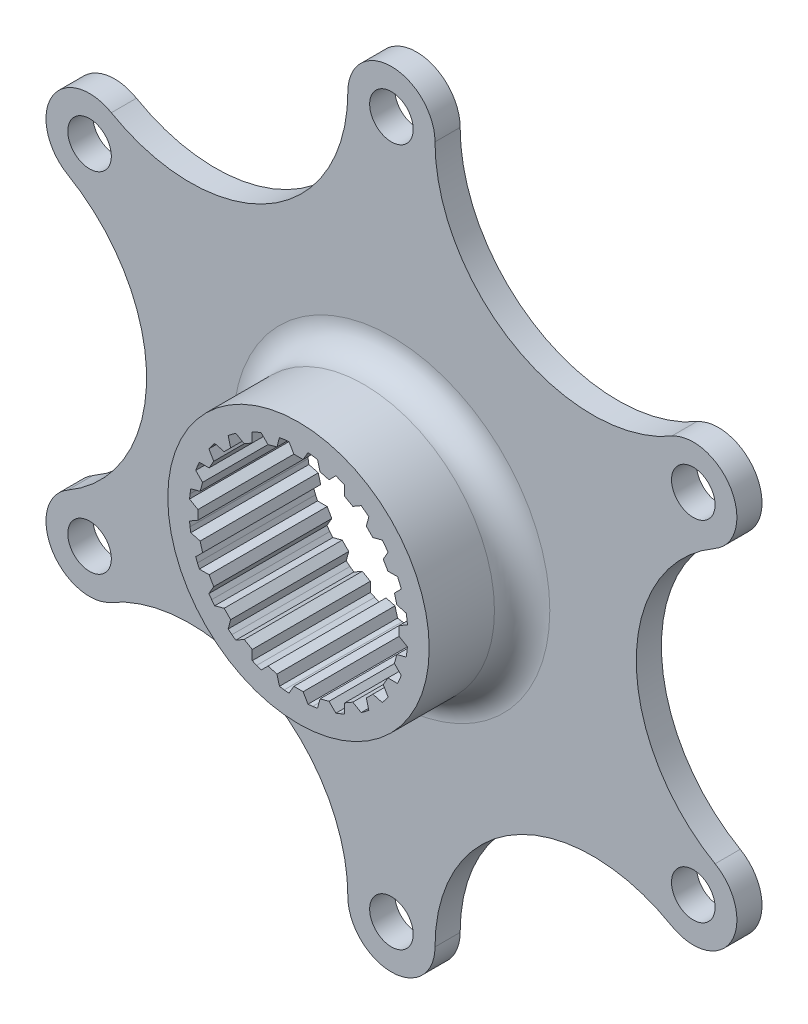
from build123d import *

# Parameters (mm, degrees)
SKETCH1_R           = 115
BOSS_EXTRUDE1_DEPTH = 13.55
CUT_EXTRUDE1_DEPTH  = 165.87695412
SKETCH3_R           = 95
SKETCH3_R_2         = 30
CUT_EXTRUDE13_DEPTH = 16.06
FILLET1_R           = 6.35
CUT_EXTRUDE14_START = -5.27
SKETCH7_R           = 95
SKETCH7_R_2         = 30
CUT_EXTRUDE14_DEPTH = 5.27
SKETCH8_R           = 115
SKETCH8_R_2         = 95
CUT_EXTRUDE17_DEPTH = 165.87695412
SKETCH9_R           = 5
CUT_EXTRUDE20_DEPTH = 138.056229337
SKETCH10_R          = 95
CUT_EXTRUDE21_DEPTH = 138.056229337
CUT_EXTRUDE22_START = -5.27
SKETCH11_R          = 30
CUT_EXTRUDE22_DEPTH = 5.27
BOSS_EXTRUDE2_START = 5.27
SKETCH13_R          = 30
BOSS_EXTRUDE2_DEPTH = 5.27


with BuildPart() as part:
    # Sketch1 → Boss-Extrude1 (new, symmetric)
    with BuildSketch(Plane.XY):
        with Locations(Location((0, 0, 0), (0, 0, 180))):
            Circle(SKETCH1_R)
    extrude(amount=BOSS_EXTRUDE1_DEPTH, both=True)

    # Sketch2 → Cut-Extrude1 (cut, through all)
    with BuildSketch(Plane.XY.offset(13.55)):
        Polygon((1.065531645, 23.075412075), (-1.065531645, 23.075412075), (-2.179683155, 25.005179098), (-3.276207422, 24.885266028), (-4.366404324, 24.717291794), (-4.943131584, 22.564916358), (-7.001580653, 22.013356593), (-8.577228829, 23.589004769), (-9.605354159, 23.189376271), (-10.614928564, 22.744961902), (-10.614928564, 20.516658882), (-12.460483511, 19.451127237), (-14.390250533, 20.565278747), (-15.279911876, 19.913168845), (-16.140062965, 19.222600444), (-15.563335705, 17.070225009), (-17.070225009, 15.563335705), (-19.222600444, 16.140062965), (-19.913168849, 15.27991187), (-20.565278747, 14.390250533), (-19.451127237, 12.460483511), (-20.516658882, 10.614928564), (-22.744961902, 10.614928564), (-23.189376274, 9.605354152), (-23.589004769, 8.577228829), (-22.013356593, 7.001580653), (-22.564916358, 4.943131584), (-24.717291794, 4.366404324), (-24.885266028, 3.276207422), (-25.005179098, 2.179683155), (-23.075412075, 1.065531645), (-23.075412075, -1.065531645), (-25.005179098, -2.179683155), (-24.885266027, -3.276207429), (-24.717291794, -4.366404324), (-22.564916358, -4.943131584), (-22.013356593, -7.001580653), (-23.589004769, -8.577228829), (-23.189376271, -9.605354159), (-22.744961902, -10.614928564), (-20.516658882, -10.614928564), (-19.451127237, -12.460483511), (-20.565278747, -14.390250533), (-19.913168845, -15.279911876), (-19.222600444, -16.140062965), (-17.070225009, -15.563335705), (-15.563335705, -17.070225009), (-16.140062965, -19.222600444), (-15.27991187, -19.913168849), (-14.390250533, -20.565278747), (-12.460483511, -19.451127237), (-10.614928564, -20.516658882), (-10.614928564, -22.744961902), (-9.605354152, -23.189376274), (-8.577228829, -23.589004769), (-7.001580653, -22.013356593), (-4.943131584, -22.564916358), (-4.366404324, -24.717291794), (-3.276207422, -24.885266028), (-2.179683155, -25.005179098), (-1.065531645, -23.075412075), (1.065531645, -23.075412075), (2.179683155, -25.005179098), (3.276207429, -24.885266027), (4.366404324, -24.717291794), (4.943131584, -22.564916358), (7.001580653, -22.013356593), (8.577228829, -23.589004769), (9.605354159, -23.189376271), (10.614928564, -22.744961902), (10.614928564, -20.516658882), (12.460483511, -19.451127237), (14.390250533, -20.565278747), (15.279911876, -19.913168845), (16.140062965, -19.222600444), (15.563335705, -17.070225009), (17.070225009, -15.563335705), (19.222600444, -16.140062965), (19.913168849, -15.27991187), (20.565278747, -14.390250533), (19.451127237, -12.460483511), (20.516658882, -10.614928564), (22.744961902, -10.614928564), (23.189376274, -9.605354152), (23.589004769, -8.577228829), (22.013356593, -7.001580653), (22.564916358, -4.943131584), (24.717291794, -4.366404324), (24.885266028, -3.276207422), (25.005179098, -2.179683155), (23.075412075, -1.065531645), (23.075412075, 1.065531645), (25.005179098, 2.179683155), (24.885266027, 3.276207429), (24.717291794, 4.366404324), (22.564916358, 4.943131584), (22.013356593, 7.001580653), (23.589004769, 8.577228829), (23.189376271, 9.605354159), (22.744961902, 10.614928564), (20.516658882, 10.614928564), (19.451127237, 12.460483511), (20.565278747, 14.390250533), (19.913168845, 15.279911876), (19.222600444, 16.140062965), (17.070225009, 15.563335705), (15.563335705, 17.070225009), (16.140062965, 19.222600444), (15.27991187, 19.913168849), (14.390250533, 20.565278747), (12.460483511, 19.451127237), (10.614928564, 20.516658882), (10.614928564, 22.744961902), (9.605354152, 23.189376274), (8.577228829, 23.589004769), (7.001580653, 22.013356593), (4.943131584, 22.564916358), (4.366404324, 24.717291794), (3.276207422, 24.885266028), (2.179683155, 25.005179098), align=None)
    extrude(amount=-CUT_EXTRUDE1_DEPTH, mode=Mode.SUBTRACT)

    # Sketch3 → Cut-Extrude13 (cut)
    with BuildSketch(Plane.XY.offset(13.55)):
        Circle(SKETCH3_R)
        Circle(SKETCH3_R_2, mode=Mode.SUBTRACT)
    extrude(amount=-CUT_EXTRUDE13_DEPTH, mode=Mode.SUBTRACT)

    # Fillet1
    fillet1_edges = [part.edges().sort_by_distance(p)[0] for p in [
        (-30, 0, -2.51),
    ]]
    fillet(fillet1_edges, radius=FILLET1_R)

    # Sketch7 → Cut-Extrude14 (cut)
    with BuildSketch(Plane(origin=(0, 0, -13.55), x_dir=(-1, 0, 0), z_dir=(0, 0, -1)).offset(CUT_EXTRUDE14_START)):
        with Locations(Location((0, 0, 0), (0, 0, 180))):
            Circle(SKETCH7_R)
        with Locations(Location((0, 0, 0), (0, 0, 180))):
            Circle(SKETCH7_R_2, mode=Mode.SUBTRACT)
    extrude(amount=CUT_EXTRUDE14_DEPTH, mode=Mode.SUBTRACT)

    # Sketch8 → Cut-Extrude17 (cut, through all)
    with BuildSketch(Plane(origin=(0, 0, -13.55), x_dir=(-1, 0, 0), z_dir=(0, 0, -1))):
        Circle(SKETCH8_R)
        Circle(SKETCH8_R_2, mode=Mode.SUBTRACT)
    extrude(amount=-CUT_EXTRUDE17_DEPTH, mode=Mode.SUBTRACT)

    # Sketch9 → Cut-Extrude20 (cut, through all)
    with BuildSketch(Plane(origin=(0, 0, -13.55), x_dir=(-1, 0, 0), z_dir=(0, 0, -1))):
        with Locations((0, 80)):
            Circle(SKETCH9_R)
        with Locations((69.282032303, 40)):
            Circle(SKETCH9_R)
        with Locations((69.282032303, -40)):
            Circle(SKETCH9_R)
        with Locations((0, -80)):
            Circle(SKETCH9_R)
        with Locations((-69.282032303, -40)):
            Circle(SKETCH9_R)
        with Locations((-69.282032303, 40)):
            Circle(SKETCH9_R)
    extrude(amount=-CUT_EXTRUDE20_DEPTH, mode=Mode.SUBTRACT)

    # Sketch10 → Cut-Extrude21 (cut, through all)
    with BuildSketch(Plane(origin=(0, 0, -13.55), x_dir=(-1, 0, 0), z_dir=(0, 0, -1))):
        Circle(SKETCH10_R)
        with BuildLine():
            ThreePointArc((-74.282032303, 31.339745962), (-77.942286341, 45), (-64.282032303, 48.660254038))
            ThreePointArc((-64.282032303, 48.660254038), (-28.09401106, 48.660254544), (-10, 80))
            ThreePointArc((-10, 80), (0, 90), (10, 80))
            ThreePointArc((10, 80), (28.09401106, 48.660254544), (64.282032303, 48.660254038))
            ThreePointArc((64.282032303, 48.660254038), (74.282032303, 48.660254038), (79.282032303, 40))
            ThreePointArc((79.282032303, 40), (77.942286341, 35), (74.282032303, 31.339745962))
            ThreePointArc((74.282032303, 31.339745962), (56.18802212, 0), (74.282032303, -31.339745962))
            ThreePointArc((74.282032303, -31.339745962), (77.942286341, -35), (79.282032303, -40))
            ThreePointArc((79.282032303, -40), (74.282032303, -48.660254038), (64.282032303, -48.660254038))
            ThreePointArc((64.282032303, -48.660254038), (28.09401106, -48.660254544), (10, -80))
            ThreePointArc((10, -80), (0, -90), (-10, -80))
            ThreePointArc((-10, -80), (-28.09401106, -48.660254544), (-64.282032303, -48.660254038))
            ThreePointArc((-64.282032303, -48.660254038), (-77.942286341, -45), (-74.282032303, -31.339745962))
            ThreePointArc((-74.282032303, -31.339745962), (-56.18802212, 0), (-74.282032303, 31.339745962))
        make_face(mode=Mode.SUBTRACT)
    extrude(amount=-CUT_EXTRUDE21_DEPTH, mode=Mode.SUBTRACT)

    # Sketch11 → Cut-Extrude22 (cut)
    with BuildSketch(Plane(origin=(0, 0, -13.55), x_dir=(-1, 0, 0), z_dir=(0, 0, -1)).offset(CUT_EXTRUDE22_START)):
        with Locations(Location((0, 0, 0), (0, 0, 180))):
            Circle(SKETCH11_R)
    extrude(amount=CUT_EXTRUDE22_DEPTH, mode=Mode.SUBTRACT)

    # Sketch13 → Boss-Extrude2 (add)
    with BuildSketch(Plane.XY.offset(13.55).offset(BOSS_EXTRUDE2_START)):
        Circle(SKETCH13_R)
        Polygon((1.065531645, 23.075412075), (-1.065531645, 23.075412075), (-2.179683155, 25.005179098), (-3.276207429, 24.885266027), (-4.366404331, 24.717291793), (-4.943131584, 22.564916358), (-7.001580653, 22.013356593), (-8.577228822, 23.589004771), (-9.605354152, 23.189376274), (-10.614928564, 22.744961902), (-10.614928564, 20.516658882), (-12.460483511, 19.451127237), (-14.390250527, 20.565278751), (-15.27991187, 19.913168849), (-16.140062965, 19.222600444), (-15.563335705, 17.070225009), (-17.070225009, 15.563335705), (-19.22260044, 16.140062971), (-19.913168845, 15.279911875), (-20.565278747, 14.390250533), (-19.451127237, 12.460483511), (-20.516658882, 10.614928564), (-22.744961899, 10.614928571), (-23.189376271, 9.605354159), (-23.589004769, 8.577228829), (-22.013356593, 7.001580653), (-22.564916358, 4.943131584), (-24.717291793, 4.366404331), (-24.885266027, 3.276207429), (-25.005179098, 2.179683155), (-23.075412075, 1.065531645), (-23.075412075, -1.065531645), (-25.005179098, -2.179683148), (-24.885266028, -3.276207422), (-24.717291794, -4.366404324), (-22.564916358, -4.943131584), (-22.013356593, -7.001580653), (-23.589004771, -8.577228822), (-23.189376274, -9.605354152), (-22.744961902, -10.614928564), (-20.516658882, -10.614928564), (-19.451127237, -12.460483511), (-20.565278751, -14.390250527), (-19.913168849, -15.27991187), (-19.222600444, -16.140062965), (-17.070225009, -15.563335705), (-15.563335705, -17.070225009), (-16.140062971, -19.22260044), (-15.279911875, -19.913168845), (-14.390250533, -20.565278747), (-12.460483511, -19.451127237), (-10.614928564, -20.516658882), (-10.614928571, -22.744961899), (-9.605354159, -23.189376271), (-8.577228829, -23.589004769), (-7.001580653, -22.013356593), (-4.943131584, -22.564916358), (-4.366404331, -24.717291793), (-3.276207429, -24.885266027), (-2.179683155, -25.005179098), (-1.065531645, -23.075412075), (1.065531645, -23.075412075), (2.179683148, -25.005179098), (3.276207422, -24.885266028), (4.366404324, -24.717291794), (4.943131584, -22.564916358), (7.001580653, -22.013356593), (8.577228822, -23.589004771), (9.605354152, -23.189376274), (10.614928564, -22.744961902), (10.614928564, -20.516658882), (12.460483511, -19.451127237), (14.390250527, -20.565278751), (15.27991187, -19.913168849), (16.140062965, -19.222600444), (15.563335705, -17.070225009), (17.070225009, -15.563335705), (19.22260044, -16.140062971), (19.913168845, -15.279911875), (20.565278747, -14.390250533), (19.451127237, -12.460483511), (20.516658882, -10.614928564), (22.744961899, -10.614928571), (23.189376271, -9.605354159), (23.589004769, -8.577228829), (22.013356593, -7.001580653), (22.564916358, -4.943131584), (24.717291793, -4.366404331), (24.885266027, -3.276207429), (25.005179098, -2.179683155), (23.075412075, -1.065531645), (23.075412075, 1.065531645), (25.005179098, 2.179683148), (24.885266028, 3.276207422), (24.717291794, 4.366404324), (22.564916358, 4.943131584), (22.013356593, 7.001580653), (23.589004771, 8.577228822), (23.189376274, 9.605354152), (22.744961902, 10.614928564), (20.516658882, 10.614928564), (19.451127237, 12.460483511), (20.565278751, 14.390250527), (19.913168849, 15.27991187), (19.222600444, 16.140062965), (17.070225009, 15.563335705), (15.563335705, 17.070225009), (16.140062971, 19.22260044), (15.279911876, 19.913168845), (14.390250533, 20.565278747), (12.460483511, 19.451127237), (10.614928564, 20.516658882), (10.614928571, 22.744961899), (9.605354159, 23.189376271), (8.577228829, 23.589004769), (7.001580653, 22.013356593), (4.943131584, 22.564916358), (4.366404331, 24.717291793), (3.276207429, 24.885266027), (2.179683155, 25.005179098), align=None, mode=Mode.SUBTRACT)
    extrude(amount=-BOSS_EXTRUDE2_DEPTH)


solid = part.part
